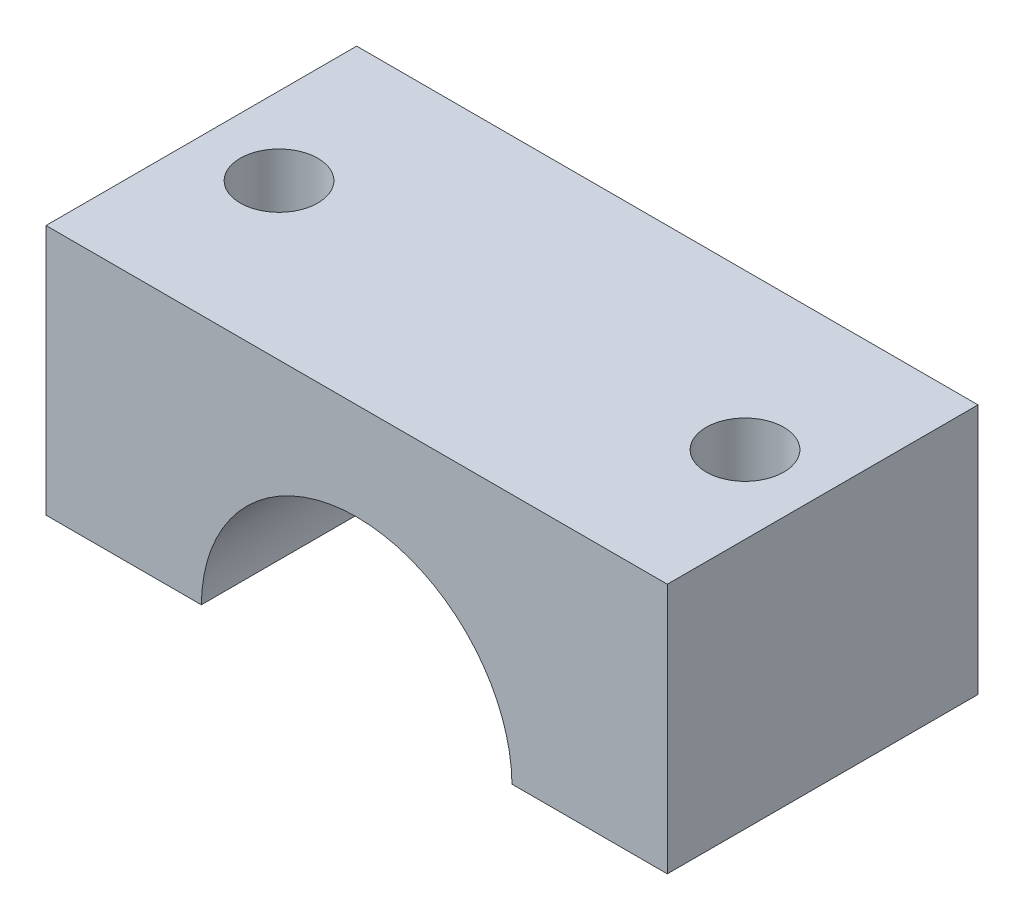
from build123d import *

# Parameters (mm, degrees)
SKETCH1_W        = 50.8
SKETCH1_H        = 25.4
BLOCK_DEPTH      = 20.5105
SKETCH3_R        = 12.7
SHAFT_HOLE_DEPTH = 42.364243136
CLAMPING_HOLES_D = 6.35


with BuildPart() as part:
    # Sketch1 → Block (new body)
    with BuildSketch(Plane(origin=(0, 0, 0), x_dir=(1, 0, 0), z_dir=(0, 1, 0))):
        Rectangle(SKETCH1_W, SKETCH1_H)
    extrude(amount=BLOCK_DEPTH)

    # Sketch3 → Shaft Hole (cut, through all)
    with BuildSketch(Plane(origin=(0, 0, -12.7), x_dir=(-1, 0, 0), z_dir=(0, 0, -1))):
        with Locations((0, -0.127)):
            Circle(SKETCH3_R)
    extrude(amount=-SHAFT_HOLE_DEPTH, mode=Mode.SUBTRACT)

    # Clamping Holes (through all)
    with Locations(Plane(origin=(0, 0, 0), x_dir=(-1, 0, 0), z_dir=(0, -1, 0))):
        with Locations((-19.05, 0), (19.05, 0)):
            Hole(CLAMPING_HOLES_D / 2)


solid = part.part
